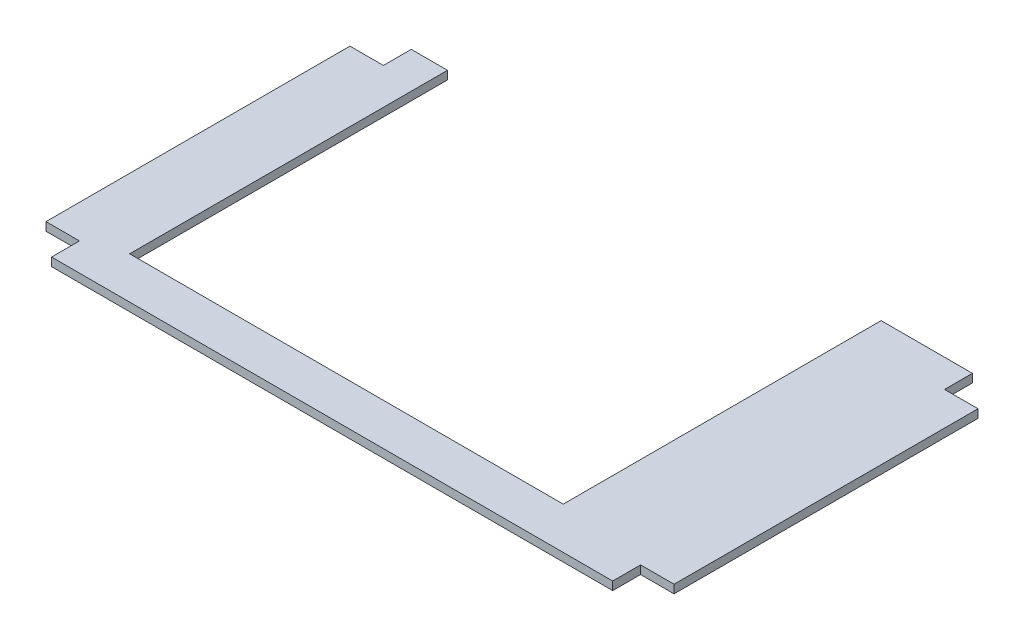
from build123d import *

# Parameters (mm, degrees)
SKETCH1_W           = 225.24
SKETCH1_H           = 129
BOSS_EXTRUDE1_DEPTH = 3
SKETCH2_W           = 12
SKETCH2_H           = 10
SKETCH2_W_2         = 155.5
SKETCH2_H_2         = 114
CUT_EXTRUDE1_DEPTH  = 172.269566473


with BuildPart() as part:
    # Sketch1 → Boss-Extrude1 (new body)
    with BuildSketch(Plane(origin=(0, 0, 0), x_dir=(1, 0, 0), z_dir=(0, 1, 0))):
        with Locations((0, 64.5)):
            Rectangle(SKETCH1_W, SKETCH1_H)
    extrude(amount=BOSS_EXTRUDE1_DEPTH)

    # Sketch2 → Cut-Extrude1 (cut, through all)
    with BuildSketch(Plane(origin=(0, 3, 0), x_dir=(1, 0, 0), z_dir=(0, 1, 0))):
        with Locations((-106.62, 124)):
            Rectangle(SKETCH2_W, SKETCH2_H)
        with Locations((106.62, 124)):
            Rectangle(SKETCH2_W, SKETCH2_H)
        with Locations((106.62, 5)):
            Rectangle(SKETCH2_W, SKETCH2_H)
        with Locations((-106.62, 5)):
            Rectangle(SKETCH2_W, SKETCH2_H)
        with Locations((-9.87, 72)):
            Rectangle(SKETCH2_W_2, SKETCH2_H_2)
    extrude(amount=-CUT_EXTRUDE1_DEPTH, mode=Mode.SUBTRACT)


solid = part.part
